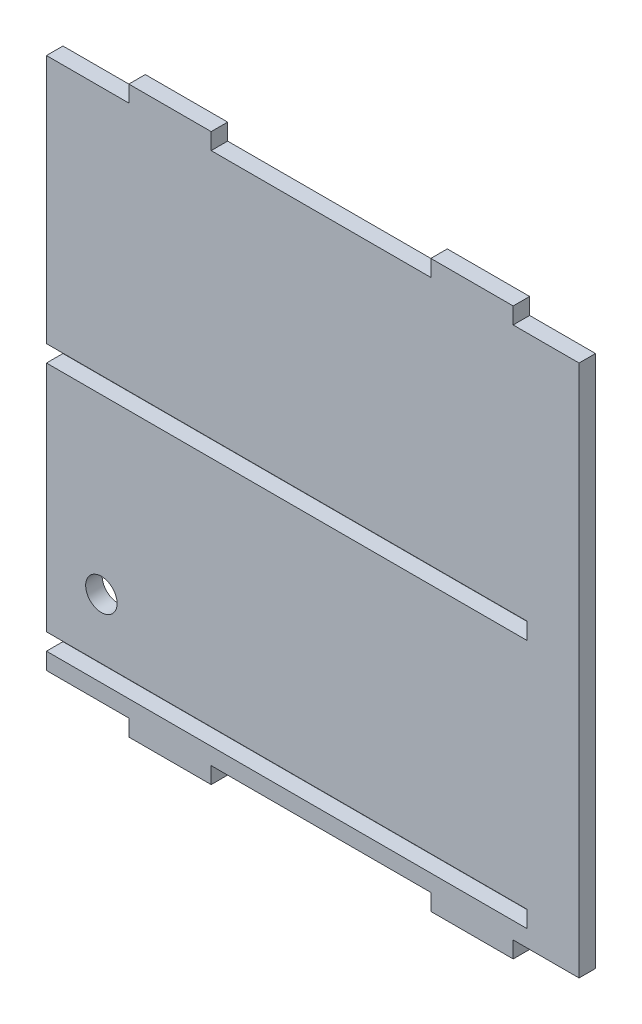
from build123d import *

# Parameters (mm, degrees)
RESSALTO_EXTRUS_O1_DEPTH = 6
ESBO_O2_W                = 175
ESBO_O2_H                = 6.1
CORTE_EXTRUS_O1_DEPTH    = 10
ESBO_O3_R                = 5.725
CORTE_EXTRUS_O2_DEPTH    = 10


with BuildPart() as part:
    # Esboço1 → Ressalto-extrusão1 (new body)
    with BuildSketch(Plane.XY):
        Polygon((-67, -97), (-97, -97), (-97, 97), (-67, 97), (-67, 103), (-37, 103), (-37, 97), (43, 97), (43, 103), (73, 103), (73, 97), (97, 97), (97, -97), (73, -97), (73, -103), (43, -103), (43, -97), (-37, -97), (-37, -103), (-67, -103), align=None)
    extrude(amount=RESSALTO_EXTRUS_O1_DEPTH)

    # Esboço2 → Corte-extrusão1 (cut)
    with BuildSketch(Plane.XY.offset(6)):
        with Locations((-9.5, 3.05)):
            Rectangle(ESBO_O2_W, ESBO_O2_H)
        with Locations((-9.5, -87.85)):
            Rectangle(ESBO_O2_W, ESBO_O2_H)
    extrude(amount=-CORTE_EXTRUS_O1_DEPTH, mode=Mode.SUBTRACT)

    # Esboço3 → Corte-extrusão2 (cut)
    with BuildSketch(Plane.XY.offset(6)):
        with Locations((-77, -63)):
            Circle(ESBO_O3_R)
    extrude(amount=-CORTE_EXTRUS_O2_DEPTH, mode=Mode.SUBTRACT)


solid = part.part
